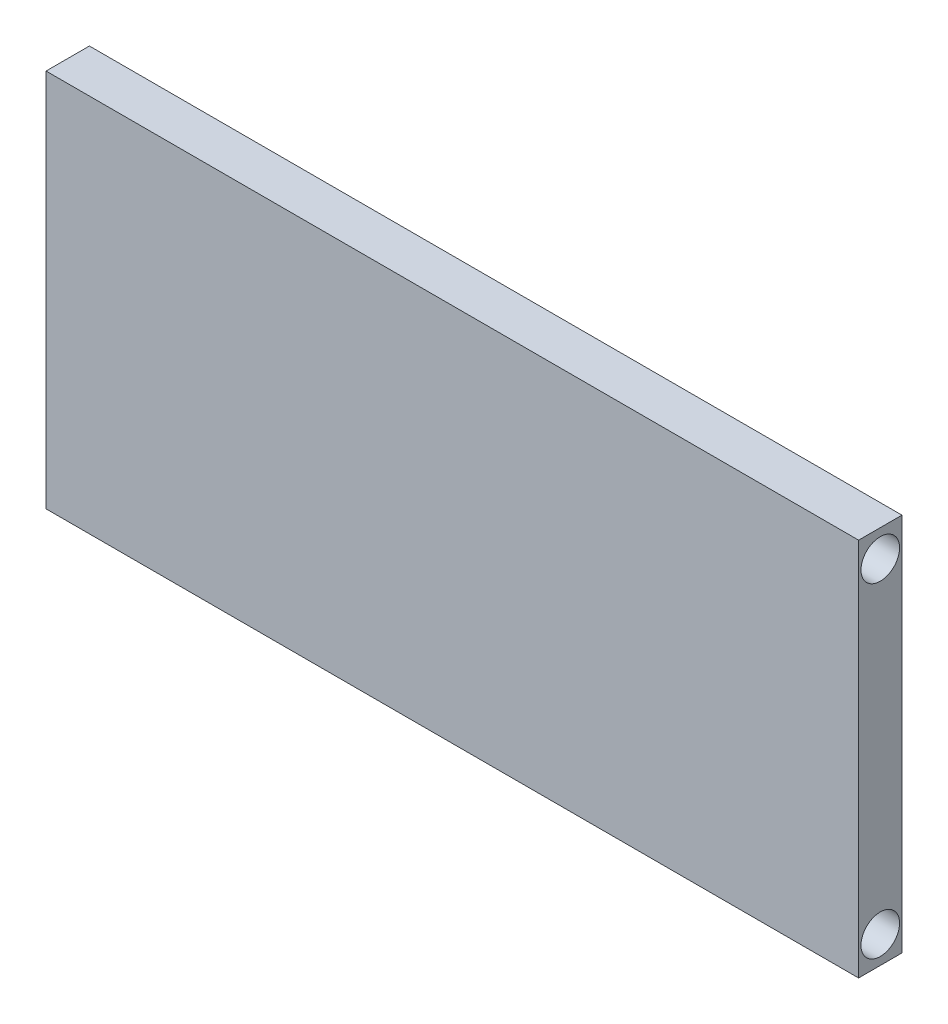
from build123d import *

# Parameters (mm, degrees)
BOSS_EXTRUDE1_DEPTH      = 4.064
BOSS_EXTRUDE1_DEPTH_BACK = 4.064
BOARD_W                  = 152.4
BOARD_H                  = 71.12
SKETCH2_R                = 3.6195
CUT_EXTRUDE1_DEPTH       = 157.546445811


with BuildPart() as part:
    # board → Boss-Extrude1 (new, two sides: drawn at the far end of the back side and taken through both)
    with BuildSketch(Plane.XY.offset(-BOSS_EXTRUDE1_DEPTH_BACK)):
        Rectangle(BOARD_W, BOARD_H)
    extrude(amount=BOSS_EXTRUDE1_DEPTH + BOSS_EXTRUDE1_DEPTH_BACK)

    # Sketch2 → Cut-Extrude1 (cut, through all)
    with BuildSketch(Plane(origin=(76.2, 0, 0), x_dir=(0, 0, -1), z_dir=(1, 0, 0))):
        with Locations((0, 30.48)):
            Circle(SKETCH2_R)
        with Locations((0, -30.48)):
            Circle(SKETCH2_R)
    extrude(amount=-CUT_EXTRUDE1_DEPTH, mode=Mode.SUBTRACT)


solid = part.part
